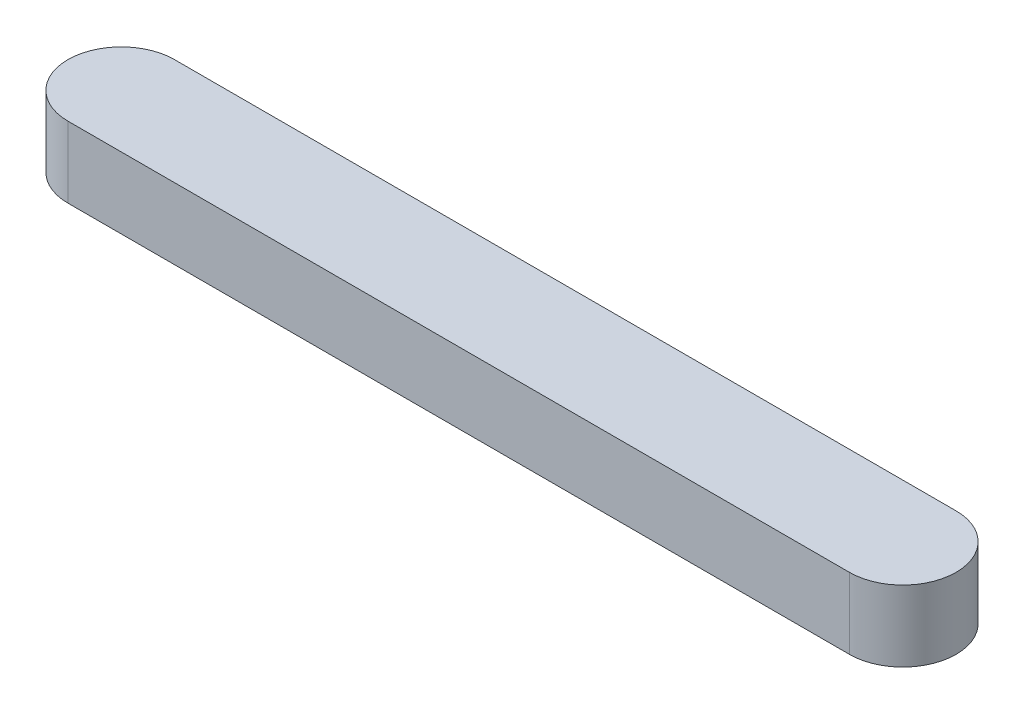
from build123d import *

# Parameters (mm, degrees)
BOSS_EXTRUDE1_DEPTH = 4


with BuildPart() as part:
    # Sketch1 → Boss-Extrude1 (new, symmetric)
    with BuildSketch(Plane(origin=(0, 0, 0), x_dir=(1, 0, 0), z_dir=(0, 1, 0))):
        with BuildLine():
            Line((-14.27027027, 6), (73.72972973, 6))
            ThreePointArc((73.72972973, 6), (79.72972973, 0), (73.72972973, -6))
            Line((73.72972973, -6), (-14.27027027, -6))
            ThreePointArc((-14.27027027, -6), (-20.27027027, 0), (-14.27027027, 6))
        make_face()
    extrude(amount=BOSS_EXTRUDE1_DEPTH, both=True)


solid = part.part
